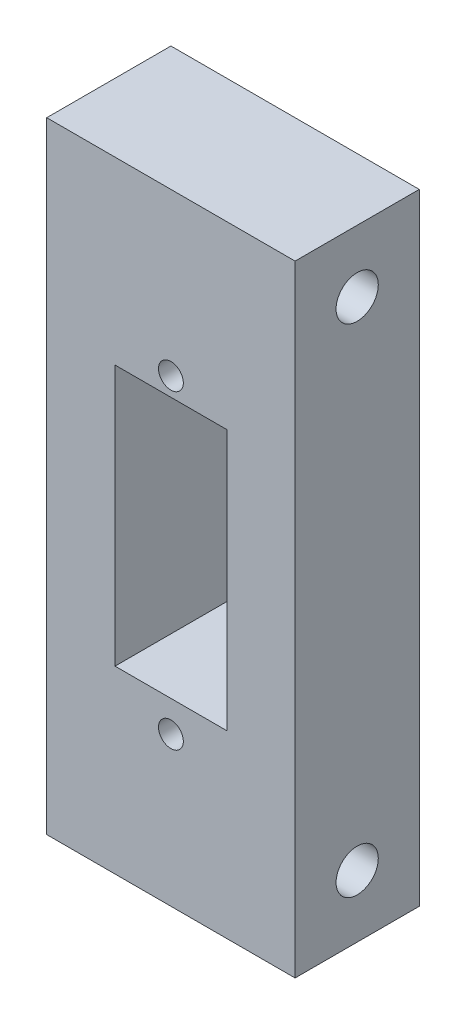
from build123d import *

# Parameters (mm, degrees)
SKETCH_3_W          = 20
SKETCH_3_H          = 50
SKETCH_3_R          = 1
SKETCH_3_W_2        = 9
SKETCH_3_H_2        = 21
EXTRUDE_1_DEPTH     = 10
SKETCH_4_R          = 1.7
CUT_EXTRUDE_1_DEPTH = 34.541019662


with BuildPart() as part:
    # 草图3 → 凸台-拉伸1 (new body)
    with BuildSketch(Plane.XY):
        Rectangle(SKETCH_3_W, SKETCH_3_H)
        with Locations((0, -13)):
            Circle(SKETCH_3_R, mode=Mode.SUBTRACT)
        with Locations((0, 12)):
            Circle(SKETCH_3_R, mode=Mode.SUBTRACT)
        Rectangle(SKETCH_3_W_2, SKETCH_3_H_2, mode=Mode.SUBTRACT)
    extrude(amount=EXTRUDE_1_DEPTH)

    # 草图4 → 切除-拉伸1 (cut, through all)
    with BuildSketch(Plane(origin=(10, 0, 0), x_dir=(0, 0, -1), z_dir=(1, 0, 0))):
        with Locations((-5, -20)):
            Circle(SKETCH_4_R)
        with Locations((-5, 20)):
            Circle(SKETCH_4_R)
    extrude(amount=-CUT_EXTRUDE_1_DEPTH, mode=Mode.SUBTRACT)


solid = part.part
